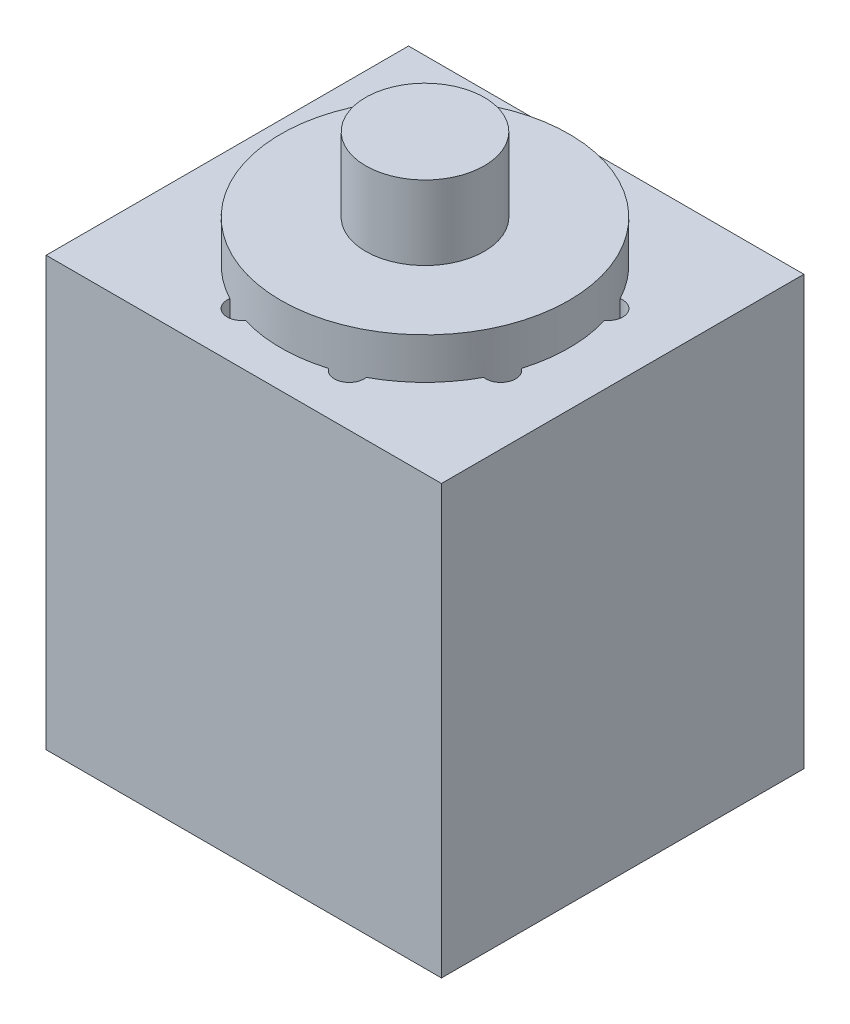
from build123d import *

# Parameters (mm, degrees)
F_01_HOUSING_PROFILE_W        = 240
F_01_HOUSING_PROFILE_H        = 220
F_01_HOUSING_PROFILE_R        = 9
F_01_HOUSING_BLOCK_DEPTH      = 260
F_02_FACE_BOSS_PROFILE_R      = 87.5
F_02_FACE_LOCATING_BOSS_DEPTH = 285
F_03_OUTPUT_SHAFT_PROFILE_R   = 36
F_03_OUTPUT_SHAFT_DEPTH       = 330


with BuildPart() as part:
    # 01_Housing_Profile → 01_Housing_Block (new body)
    with BuildSketch(Plane(origin=(0, 0, 0), x_dir=(1, 0, 0), z_dir=(0, 1, 0))):
        Rectangle(F_01_HOUSING_PROFILE_W, F_01_HOUSING_PROFILE_H)
        with Locations(Location((78.529760263, 32.528091751, 0), (0, 0, 270))):
            Circle(F_01_HOUSING_PROFILE_R, mode=Mode.SUBTRACT)
        with Locations(Location((32.528091751, 78.529760263, 0), (0, 0, 270))):
            Circle(F_01_HOUSING_PROFILE_R, mode=Mode.SUBTRACT)
        with Locations(Location((-32.528091751, 78.529760263, 0), (0, 0, 270))):
            Circle(F_01_HOUSING_PROFILE_R, mode=Mode.SUBTRACT)
        with Locations(Location((-78.529760263, 32.528091751, 0), (0, 0, 270))):
            Circle(F_01_HOUSING_PROFILE_R, mode=Mode.SUBTRACT)
        with Locations(Location((-78.529760263, -32.528091751, 0), (0, 0, 270))):
            Circle(F_01_HOUSING_PROFILE_R, mode=Mode.SUBTRACT)
        with Locations(Location((-32.528091751, -78.529760263, 0), (0, 0, 270))):
            Circle(F_01_HOUSING_PROFILE_R, mode=Mode.SUBTRACT)
        with Locations(Location((32.528091751, -78.529760263, 0), (0, 0, 270))):
            Circle(F_01_HOUSING_PROFILE_R, mode=Mode.SUBTRACT)
        with Locations(Location((78.529760263, -32.528091751, 0), (0, 0, 270))):
            Circle(F_01_HOUSING_PROFILE_R, mode=Mode.SUBTRACT)
    extrude(amount=F_01_HOUSING_BLOCK_DEPTH)

    # 02_Face_Boss_Profile → 02_Face_Locating_Boss (add)
    with BuildSketch(Plane(origin=(0, 0, 0), x_dir=(1, 0, 0), z_dir=(0, 1, 0))):
        with Locations(Location((0, 0, 0), (0, 0, 73.24641223))):
            Circle(F_02_FACE_BOSS_PROFILE_R)
    extrude(amount=F_02_FACE_LOCATING_BOSS_DEPTH)

    # 03_Output_Shaft_Profile → 03_Output_Shaft (add)
    with BuildSketch(Plane(origin=(0, 0, 0), x_dir=(1, 0, 0), z_dir=(0, 1, 0))):
        with Locations(Location((0, 0, 0), (0, 0, 270))):
            Circle(F_03_OUTPUT_SHAFT_PROFILE_R)
    extrude(amount=F_03_OUTPUT_SHAFT_DEPTH)


solid = part.part
